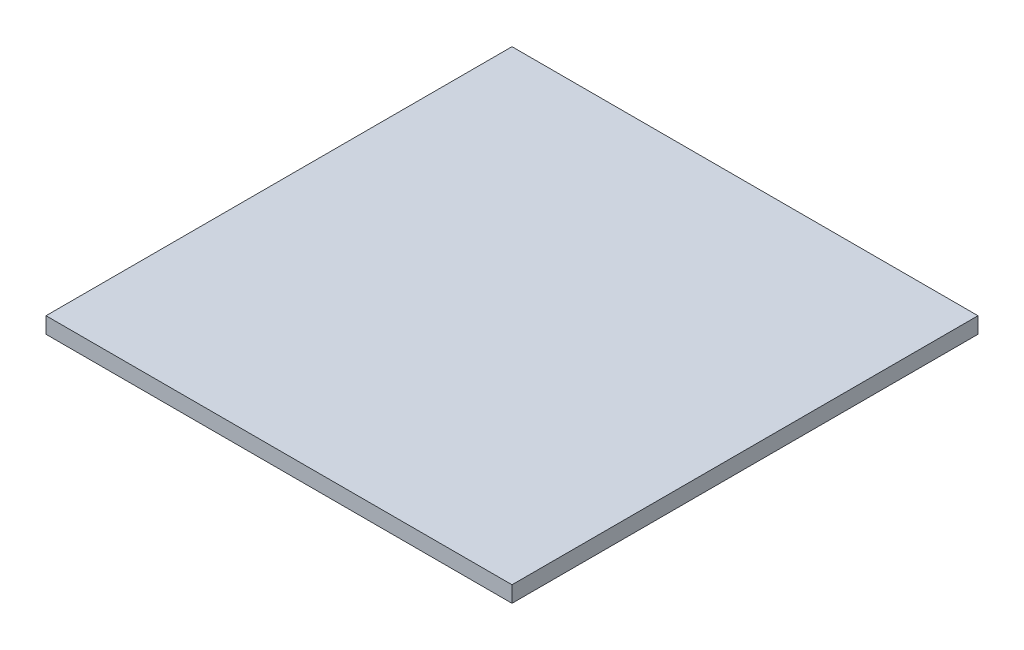
from build123d import *

# Parameters (mm, degrees)
SKETCH1_W           = 154.432
SKETCH1_H           = 154.432
BOSS_EXTRUDE1_DEPTH = 5.334


with BuildPart() as part:
    # Sketch1 → Boss-Extrude1 (new body)
    with BuildSketch(Plane(origin=(0, 0, 0), x_dir=(1, 0, 0), z_dir=(0, 1, 0))):
        Rectangle(SKETCH1_W, SKETCH1_H)
    extrude(amount=BOSS_EXTRUDE1_DEPTH)


solid = part.part
